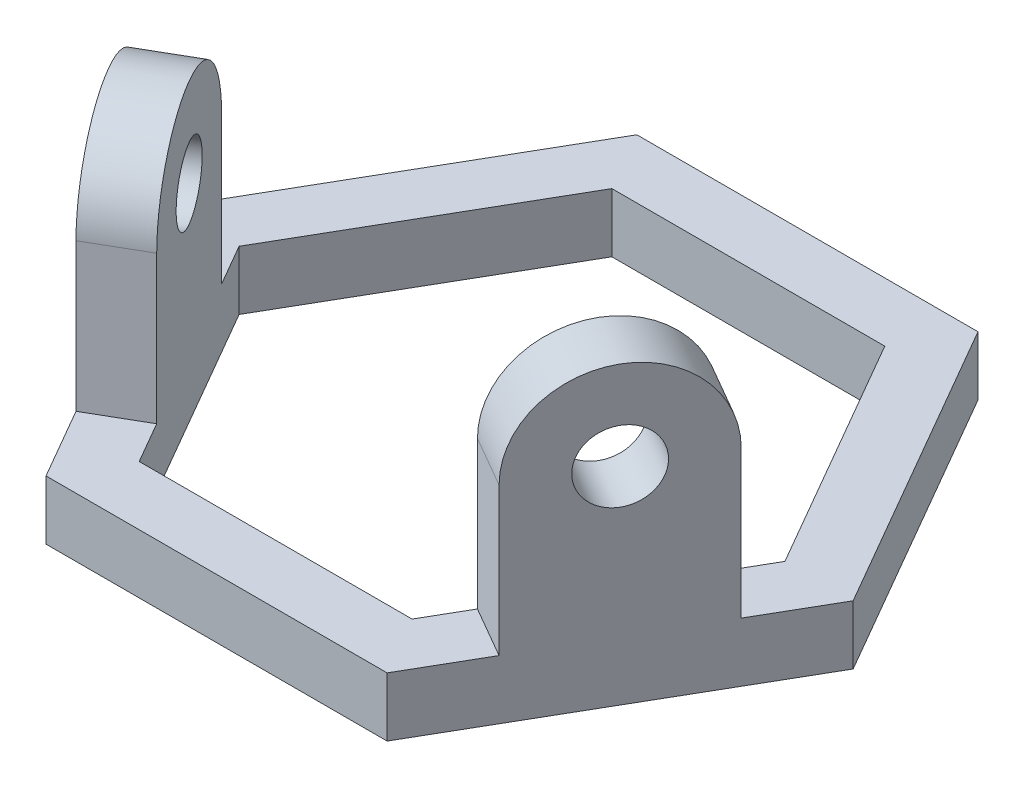
from build123d import *

# Parameters (mm, degrees)
DODANIE_WYCI_GNI_CIE1_DEPTH = 10
SZKIC2_R                    = 6
DODANIE_WYCI_GNI_CIE2_DEPTH = 10
SZKIC3_R                    = 6
DODANIE_WYCI_GNI_CIE3_DEPTH = 10


with BuildPart() as part:
    # Szkic1 → Dodanie-wyciągnięcie1 (new body)
    with BuildSketch(Plane(origin=(0, 0, 0), x_dir=(1, 0, 0), z_dir=(0, 1, 0))):
        Polygon((57.735026919, 0), (28.867513459, 50), (-28.867513459, 50), (-57.735026919, 0), (-28.867513459, -50), (28.867513459, -50), align=None)
        Polygon((23.094010768, 40), (-23.094010768, 40), (-46.188021535, 0), (-23.094010768, -40), (23.094010768, -40), (46.188021535, 0), align=None, mode=Mode.SUBTRACT)
    extrude(amount=DODANIE_WYCI_GNI_CIE1_DEPTH)

    # Szkic2 → Dodanie-wyciągnięcie2 (add)
    with BuildSketch(Plane(origin=(43.301270189, 0, 25), x_dir=(0.49999999999999034, 0, -0.8660254037844444), z_dir=(0.8660254037844444, 0, 0.49999999999999034))):
        with BuildLine():
            Line((-15, 35), (-15, 0))
            Line((-15, 0), (15, 0))
            Line((15, 0), (15, 35))
            ThreePointArc((15, 35), (0, 50), (-15, 35))
        make_face()
        with Locations((0, 35)):
            Circle(SZKIC2_R, mode=Mode.SUBTRACT)
    extrude(amount=-DODANIE_WYCI_GNI_CIE2_DEPTH)

    # Szkic3 → Dodanie-wyciągnięcie3 (add)
    with BuildSketch(Plane(origin=(-43.301270189, 0, 25), x_dir=(0.5000000000000085, 0, 0.8660254037844338), z_dir=(-0.8660254037844337, 0, 0.5000000000000084))):
        with BuildLine():
            Line((-15, 35), (-15, 0))
            Line((-15, 0), (15, 0))
            Line((15, 0), (15, 35))
            ThreePointArc((15, 35), (0, 50), (-15, 35))
        make_face()
        with Locations((0, 35)):
            Circle(SZKIC3_R, mode=Mode.SUBTRACT)
    extrude(amount=-DODANIE_WYCI_GNI_CIE3_DEPTH)


solid = part.part
